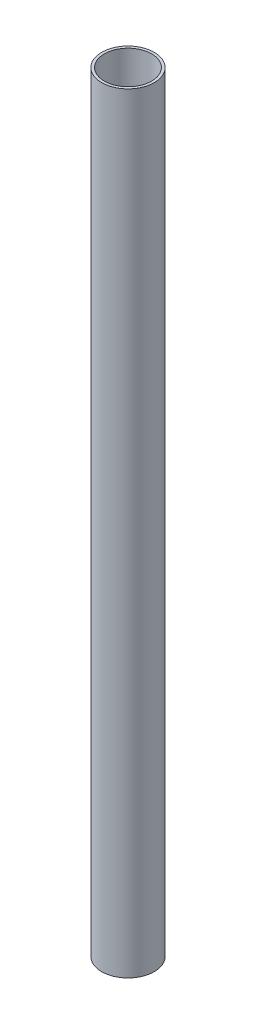
from build123d import *

# Parameters (mm, degrees)
SKETCH1_R           = 20
SKETCH1_R_2         = 18
BOSS_EXTRUDE1_DEPTH = 586


with BuildPart() as part:
    # Sketch1 → Boss-Extrude1 (new body)
    with BuildSketch(Plane(origin=(0, 0, 0), x_dir=(1, 0, 0), z_dir=(0, 1, 0))):
        with Locations(Location((0, 0, 0), (0, 0, 270))):
            Circle(SKETCH1_R)
        with Locations(Location((0, 0, 0), (0, 0, 270))):
            Circle(SKETCH1_R_2, mode=Mode.SUBTRACT)
    extrude(amount=BOSS_EXTRUDE1_DEPTH)


solid = part.part
